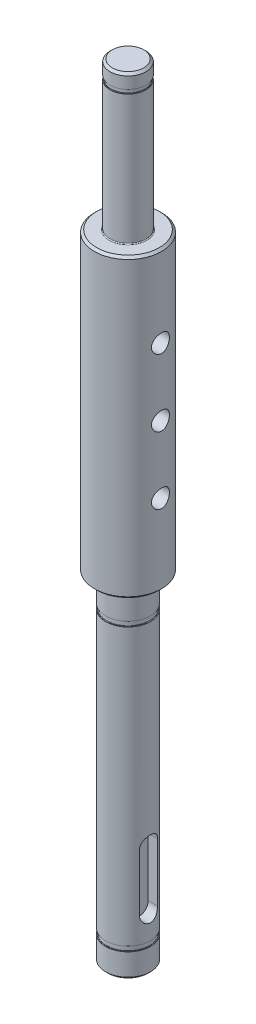
from build123d import *

# Parameters (mm, degrees)
BOSS_EXTRUDE4_START = 30
SKETCH17_R          = 5
BOSS_EXTRUDE4_DEPTH = 30
CUT_EXTRUDE1_DEPTH  = 2.5
SKETCH27_R          = 7.5
BOSS_EXTRUDE5_DEPTH = 33.5
SKETCH30_R          = 7.5
SKETCH30_R_2        = 5
CUT_EXTRUDE5_DEPTH  = 27.3
SKETCH24_R          = 2
CUT_EXTRUDE4_DEPTH  = 191.240637089
SKETCH35_R          = 5
CUT_EXTRUDE6_DEPTH  = 15
CHAMFER2_SIZE       = 0.5
FILLET2_R           = 0.2


with BuildPart() as part:
    # Sketch1 → Revolve1 (revolve)
    with BuildSketch(Plane.XY, mode=Mode.PRIVATE) as revolve1_sk:
        Polygon((0, 189.5), (4, 189.5), (4, 156.5), (5, 156.5), (5, 123), (7.5, 123), (7.5, 63), (5, 63), (5, 30), (4, 30), (4, 0), (0, 0), align=None)
    revolve(revolve1_sk.sketch.rotate(Axis((0, 27.535863038, 0), (0, -1, 0)), 90), axis=Axis((0, 27.535863038, 0), (0, -1, 0)))

    # Sketch17 → Boss-Extrude4 (add)
    with BuildSketch(Plane.XZ.offset(-30).offset(BOSS_EXTRUDE4_START)):
        with Locations(Location((0, 0, 0), (0, 0, 90))):
            Circle(SKETCH17_R)
    extrude(amount=-BOSS_EXTRUDE4_DEPTH)

    # Sketch2 → Cut-Extrude1 (cut)
    with BuildSketch(Plane(origin=(5, 0, 0), x_dir=(0, 0, -1), z_dir=(1, 0, 0))):
        with BuildLine():
            Line((2, 40), (2, 27))
            ThreePointArc((2, 27), (0, 25), (-2, 27))
            Line((-2, 27), (-2, 40))
            ThreePointArc((-2, 40), (0, 42), (2, 40))
        make_face()
    extrude(amount=-CUT_EXTRUDE1_DEPTH, mode=Mode.SUBTRACT)

    # Sketch19 → Groove for BS 3673 P4 - S010M_ External (revolve, cut)
    with BuildSketch(Plane(origin=(0, 27.535863038, 0), x_dir=(0, 0, 1), z_dir=(-1, 0, 0))):
        with BuildLine():
            Line((4.91, 101.464136962), (6, 101.464136962))
            Line((6, 101.464136962), (6, 102.564136962))
            Line((6, 102.564136962), (4.91, 102.564136962))
            ThreePointArc((4.91, 102.564136962), (4.832218254, 102.531918708), (4.8, 102.454136962))
            Line((4.8, 102.454136962), (4.8, 101.574136962))
            ThreePointArc((4.8, 101.574136962), (4.832218254, 101.496355216), (4.91, 101.464136962))
        make_face()
    revolve(axis=Axis((0, -22.464136962, 0), (0, 1, 0)), mode=Mode.SUBTRACT)

    # Sketch21 → Groove for BS 3673 P4 - S010M_ Exter 2 (revolve, cut)
    with BuildSketch(Plane(origin=(0, 27.535863038, 0), x_dir=(0, 0, 1), z_dir=(-1, 0, 0))):
        with BuildLine():
            Line((4.91, -7.135863038), (6, -7.135863038))
            Line((6, -7.135863038), (6, -6.035863038))
            Line((6, -6.035863038), (4.91, -6.035863038))
            ThreePointArc((4.91, -6.035863038), (4.832218254, -6.068081292), (4.8, -6.145863038))
            Line((4.8, -6.145863038), (4.8, -7.025863038))
            ThreePointArc((4.8, -7.025863038), (4.832218254, -7.103644784), (4.91, -7.135863038))
        make_face()
    revolve(axis=Axis((0, -22.464136962, 0), (0, 1, 0)), mode=Mode.SUBTRACT)

    # Sketch27 → Boss-Extrude5 (add)
    with BuildSketch(Plane(origin=(0, 123, 0), x_dir=(1, 0, 0), z_dir=(0, 1, 0))):
        with Locations(Location((0, 0, 0), (0, 0, 270))):
            Circle(SKETCH27_R)
    extrude(amount=BOSS_EXTRUDE5_DEPTH)

    # Sketch30 → Cut-Extrude5 (cut)
    with BuildSketch(Plane.XZ.offset(-63)):
        with Locations(Location((0, 0, 0), (0, 0, 270))):
            Circle(SKETCH30_R)
        with Locations(Location((0, 0, 0), (0, 0, 270))):
            Circle(SKETCH30_R_2, mode=Mode.SUBTRACT)
    extrude(amount=-CUT_EXTRUDE5_DEPTH, mode=Mode.SUBTRACT)

    # Sketch32 → Groove for BS 3673 P4 - S008M, External Circlip1 (revolve, cut)
    with BuildSketch(Plane(origin=(0, 27.535863038, 0), x_dir=(0, 0, 1), z_dir=(-1, 0, 0))):
        with BuildLine():
            Line((3.89, 157.964136962), (4.8, 157.964136962))
            Line((4.8, 157.964136962), (4.8, 158.864136962))
            Line((4.8, 158.864136962), (3.89, 158.864136962))
            ThreePointArc((3.89, 158.864136962), (3.82636039, 158.837776572), (3.8, 158.774136962))
            Line((3.8, 158.774136962), (3.8, 158.054136962))
            ThreePointArc((3.8, 158.054136962), (3.82636039, 157.990497351), (3.89, 157.964136962))
        make_face()
    revolve(axis=Axis((0, -22.464136962, 0), (0, 1, 0)), mode=Mode.SUBTRACT)

    # Sketch34 → Groove for BS 3673 P4 - S010M_ Exter 3 (revolve, cut)
    with BuildSketch(Plane(origin=(0, 27.535863038, 0), x_dir=(0, 0, 1), z_dir=(-1, 0, 0))):
        with BuildLine():
            Line((4.91, 55.664136962), (6, 55.664136962))
            Line((6, 55.664136962), (6, 56.764136962))
            Line((6, 56.764136962), (4.91, 56.764136962))
            ThreePointArc((4.91, 56.764136962), (4.832218254, 56.731918708), (4.8, 56.654136962))
            Line((4.8, 56.654136962), (4.8, 55.774136962))
            ThreePointArc((4.8, 55.774136962), (4.832218254, 55.696355216), (4.91, 55.664136962))
        make_face()
    revolve(axis=Axis((0, -22.464136962, 0), (0, 1, 0)), mode=Mode.SUBTRACT)

    # Sketch24 → Cut-Extrude4 (cut, through all)
    with BuildSketch(Plane(origin=(7.5, 0, 0), x_dir=(0, 0, -1), z_dir=(1, 0, 0))):
        with Locations((0, 108.3)):
            Circle(SKETCH24_R)
        with Locations((0, 123.3)):
            Circle(SKETCH24_R)
        with Locations((0, 138.3)):
            Circle(SKETCH24_R)
    extrude(amount=-CUT_EXTRUDE4_DEPTH, mode=Mode.SUBTRACT)

    # Sketch35 → Cut-Extrude6 (cut)
    with BuildSketch(Plane.XZ):
        with Locations(Location((0, 0, 0), (0, 0, 90))):
            Circle(SKETCH35_R)
    extrude(amount=-CUT_EXTRUDE6_DEPTH, mode=Mode.SUBTRACT)

    # Chamfer2
    chamfer2_edges = [part.edges().sort_by_distance(p)[0] for p in [
        (0, 15, -5),
        (0, 189.5, -4),
        (0, 156.5, -7.5),
        (0, 90.3, -7.5),
    ]]
    chamfer(chamfer2_edges, length=CHAMFER2_SIZE)

    # Fillet2
    fillet2_edges = [part.edges().sort_by_distance(p)[0] for p in [
        (0, 156.5, -4),
        (0, 90.3, 5),
    ]]
    fillet(fillet2_edges, radius=FILLET2_R)


solid = part.part
